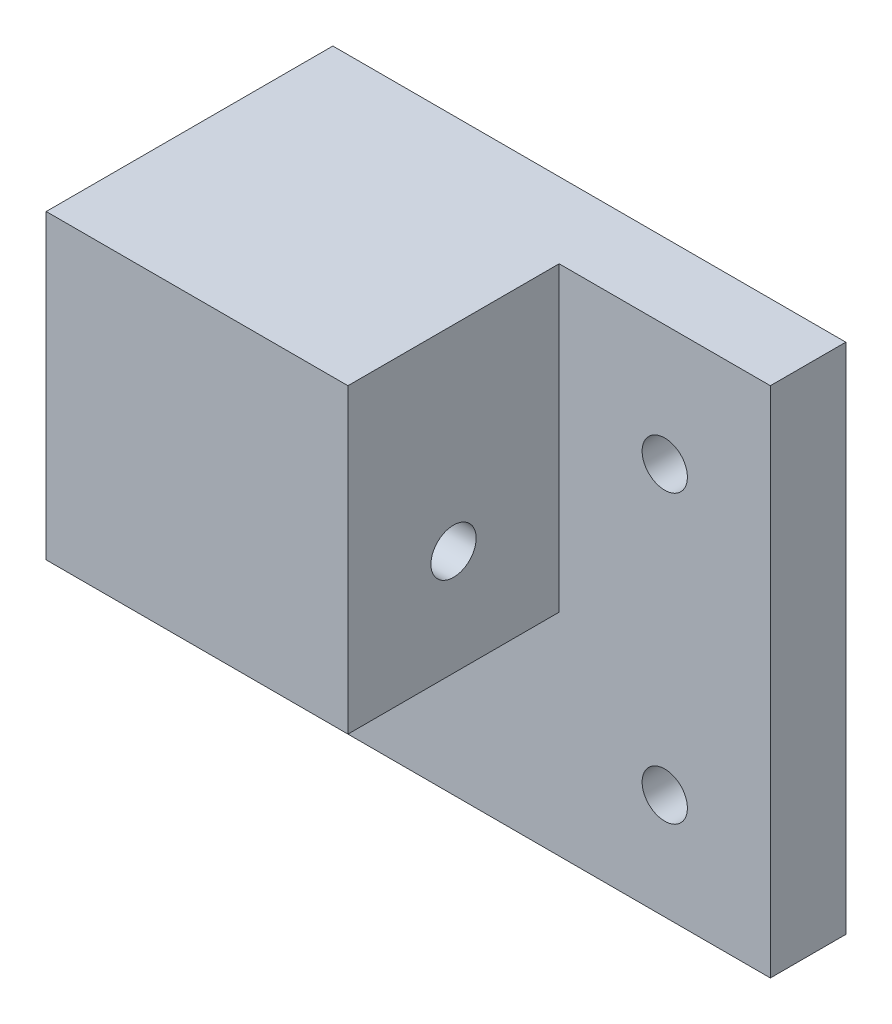
from build123d import *

# Parameters (mm, degrees)
IZIM1_W                     = 68
IZIM1_H                     = 68
Y_KSEKLIK_EKSTR_ZYON1_DEPTH = 10
IZIM2_W                     = 40
IZIM2_H                     = 40
Y_KSEKLIK_EKSTR_ZYON2_DEPTH = 28
IZIM3_R                     = 3
KES_EKSTR_ZYON1_DEPTH       = 20
IZIM4_R                     = 3
KES_EKSTR_ZYON2_DEPTH       = 20
IZIM5_R                     = 3
KES_EKSTR_ZYON3_DEPTH       = 101.159872204


with BuildPart() as part:
    # Çizim1 → Yükseklik-Ekstrüzyon1 (new body)
    with BuildSketch(Plane.XY):
        with Locations((-34, -34)):
            Rectangle(IZIM1_W, IZIM1_H)
    extrude(amount=Y_KSEKLIK_EKSTR_ZYON1_DEPTH)

    # Çizim2 → Yükseklik-Ekstrüzyon2 (add)
    with BuildSketch(Plane.XY.offset(10)):
        with Locations((-48, -20)):
            Rectangle(IZIM2_W, IZIM2_H)
    extrude(amount=Y_KSEKLIK_EKSTR_ZYON2_DEPTH)

    # Çizim3 → Kes-Ekstrüzyon1 (cut)
    with BuildSketch(Plane.XZ.offset(40)):
        with Locations(Location((-42, 24, 0), (0, 0, 270))):
            Circle(IZIM3_R)
    extrude(amount=-KES_EKSTR_ZYON1_DEPTH, mode=Mode.SUBTRACT)

    # Çizim4 → Kes-Ekstrüzyon2 (cut)
    with BuildSketch(Plane(origin=(-28, 0, 0), x_dir=(0, 0, -1), z_dir=(1, 0, 0))):
        with Locations(Location((-24, -26, 0), (0, 0, 90))):
            Circle(IZIM4_R)
    extrude(amount=-KES_EKSTR_ZYON2_DEPTH, mode=Mode.SUBTRACT)

    # Çizim5 → Kes-Ekstrüzyon3 (cut, through all)
    with BuildSketch(Plane.XY.offset(10)):
        with Locations((-14, -54)):
            Circle(IZIM5_R)
        with Locations((-14, -16)):
            Circle(IZIM5_R)
        with Locations((-52, -54)):
            Circle(IZIM5_R)
    extrude(amount=-KES_EKSTR_ZYON3_DEPTH, mode=Mode.SUBTRACT)


solid = part.part
